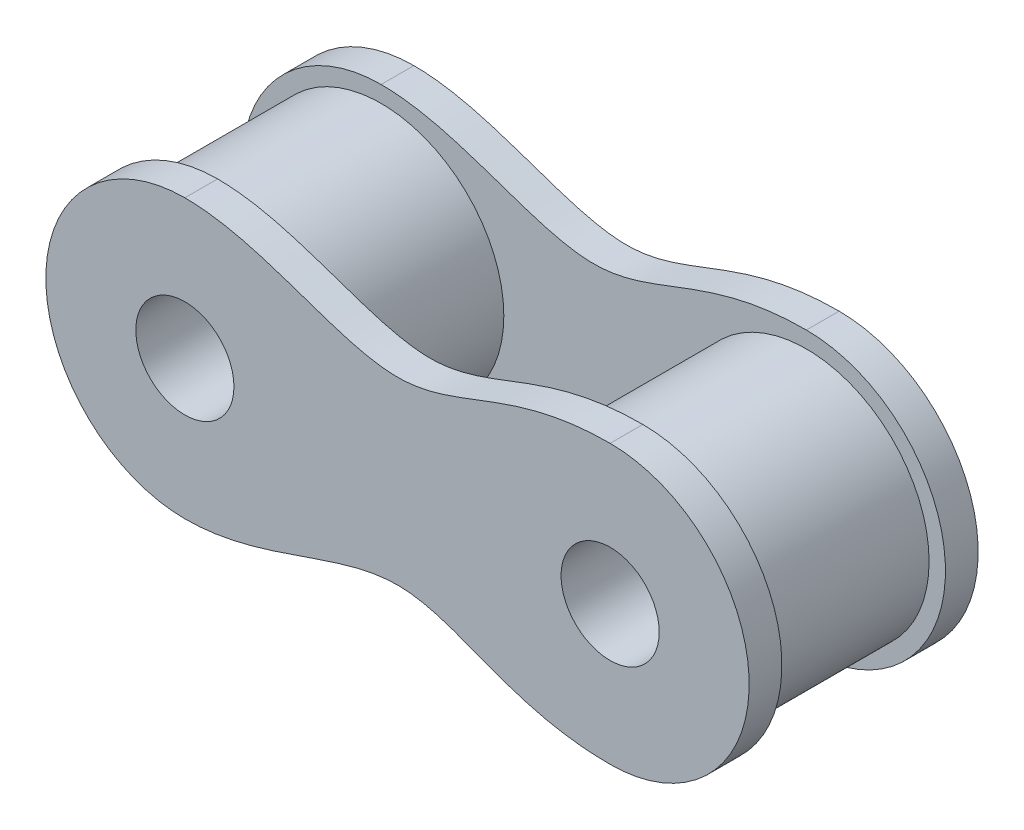
from build123d import *

# Parameters (mm, degrees)
SKETCH1_R             = 3.75
SKETCH1_R_2           = 1.5
BOSS_EXTRUDE1_DEPTH   = 5
BOSS_EXTRUDE1_2_DEPTH = 5
SKETCH2_R             = 1.5
BOSS_EXTRUDE2_DEPTH   = 1


with BuildPart() as part:
    # Sketch1 → Boss-Extrude1 (new body)
    with BuildSketch(Plane.XY):
        Circle(SKETCH1_R)
        Circle(SKETCH1_R_2, mode=Mode.SUBTRACT)
    extrude(amount=BOSS_EXTRUDE1_DEPTH)



with BuildPart() as body_2:
    # Sketch1 → Boss-Extrude1 2 (new body)
    with BuildSketch(Plane.XY):
        with Locations((13, 0)):
            Circle(SKETCH1_R)
        with Locations((13, 0)):
            Circle(SKETCH1_R_2, mode=Mode.SUBTRACT)
    extrude(amount=BOSS_EXTRUDE1_2_DEPTH)


with BuildPart() as part_1:
    add(part.part)

    add(body_2.part)  # Boss-Extrude2 merges body 2
    # Sketch2 → Boss-Extrude2 (add)
    with BuildSketch(Plane.XY.offset(5)):
        with BuildLine():
            ThreePointArc((0, 4.25), (-4.25, 0), (0, -4.25))
            add(Edge.make_bspline(
                [(0, -4.25), (2.386303511, -4.25), (6.863643386, -1.25), (9.886409718, -4.25), (13, -4.25)],
                knots=[0, 0, 0, 0, 0.5, 1, 1, 1, 1], degree=3))
            ThreePointArc((13, -4.25), (17.25, 0), (13, 4.25))
            add(Edge.make_bspline(
                [(0, 4.25), (2.386303511, 4.25), (6.863643386, 1.25), (9.886409718, 4.25), (13, 4.25)],
                knots=[0, 0, 0, 0, 0.5, 1, 1, 1, 1], degree=3))
        make_face()
        Circle(SKETCH2_R, mode=Mode.SUBTRACT)
        with Locations((13, 0)):
            Circle(SKETCH2_R, mode=Mode.SUBTRACT)
    boss_extrude2 = extrude(amount=BOSS_EXTRUDE2_DEPTH)

    # Mirror1: Boss-Extrude2 across plane
    add(boss_extrude2.mirror(Plane(origin=(0, 0, 2.5), x_dir=(1, 0, 0), z_dir=(0, 0, -1))))


solid = part_1.part
